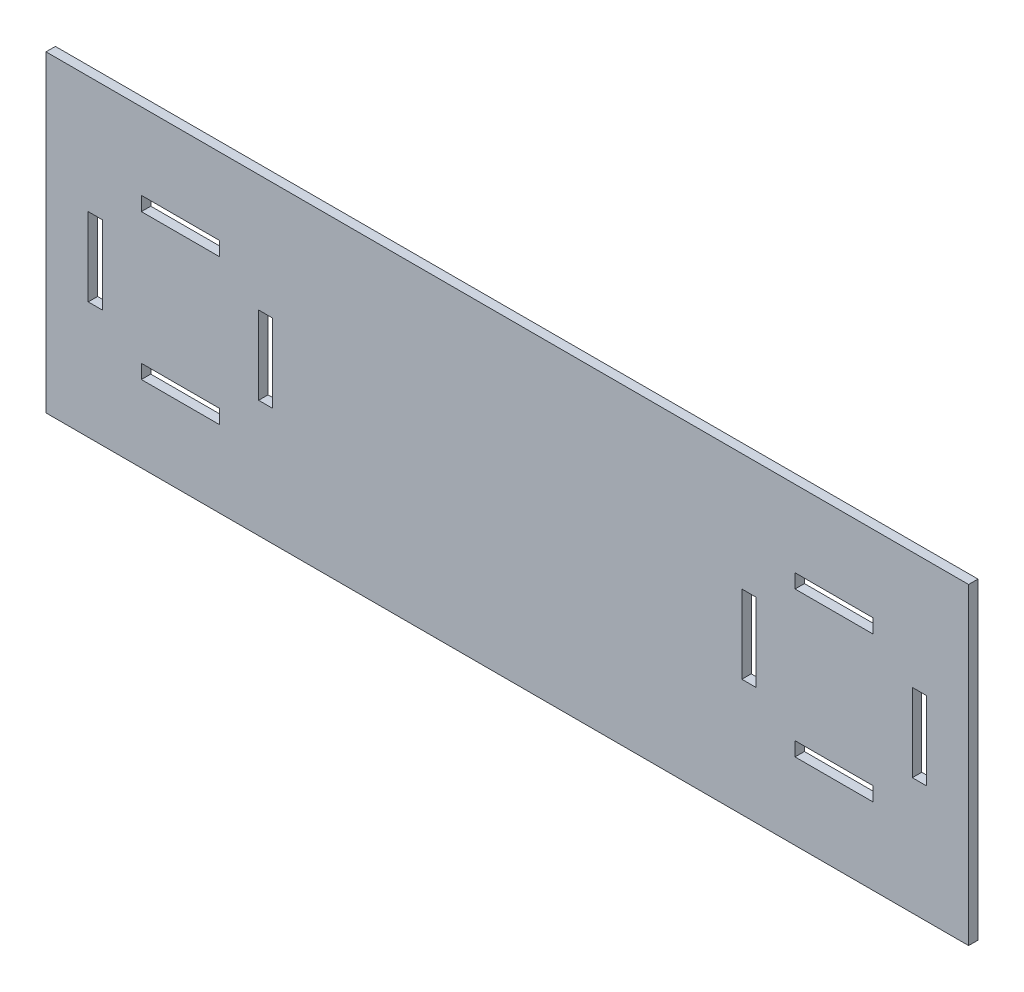
from build123d import *

# Parameters (mm, degrees)
ESBO_O1_W                = 295
ESBO_O1_H                = 100
RESSALTO_EXTRUS_O1_DEPTH = 3
ESBO_O2_W                = 4.5
ESBO_O2_H                = 25
ESBO_O2_W_2              = 25
ESBO_O2_H_2              = 4.5
CORTE_EXTRUS_O1_DEPTH    = 156.773072127


with BuildPart() as part:
    # Esboço1 → Ressalto-extrusão1 (new body)
    with BuildSketch(Plane.XY):
        Rectangle(ESBO_O1_W, ESBO_O1_H)
    extrude(amount=RESSALTO_EXTRUS_O1_DEPTH)

    # Esboço2 → Corte-extrusão1 (cut, through all)
    with BuildSketch(Plane.XY.offset(3)):
        with Locations((131.75, 0)):
            Rectangle(ESBO_O2_W, ESBO_O2_H)
        with Locations((-77.25, 0)):
            Rectangle(ESBO_O2_W, ESBO_O2_H)
        with Locations((-131.75, 0)):
            Rectangle(ESBO_O2_W, ESBO_O2_H)
        with Locations((-104.5, 23.25)):
            Rectangle(ESBO_O2_W_2, ESBO_O2_H_2)
        with Locations((-104.5, -23.25)):
            Rectangle(ESBO_O2_W_2, ESBO_O2_H_2)
        with Locations((77.25, 0)):
            Rectangle(ESBO_O2_W, ESBO_O2_H)
        with Locations((104.5, -23.25)):
            Rectangle(ESBO_O2_W_2, ESBO_O2_H_2)
        with Locations((104.5, 23.25)):
            Rectangle(ESBO_O2_W_2, ESBO_O2_H_2)
    extrude(amount=-CORTE_EXTRUS_O1_DEPTH, mode=Mode.SUBTRACT)


solid = part.part
